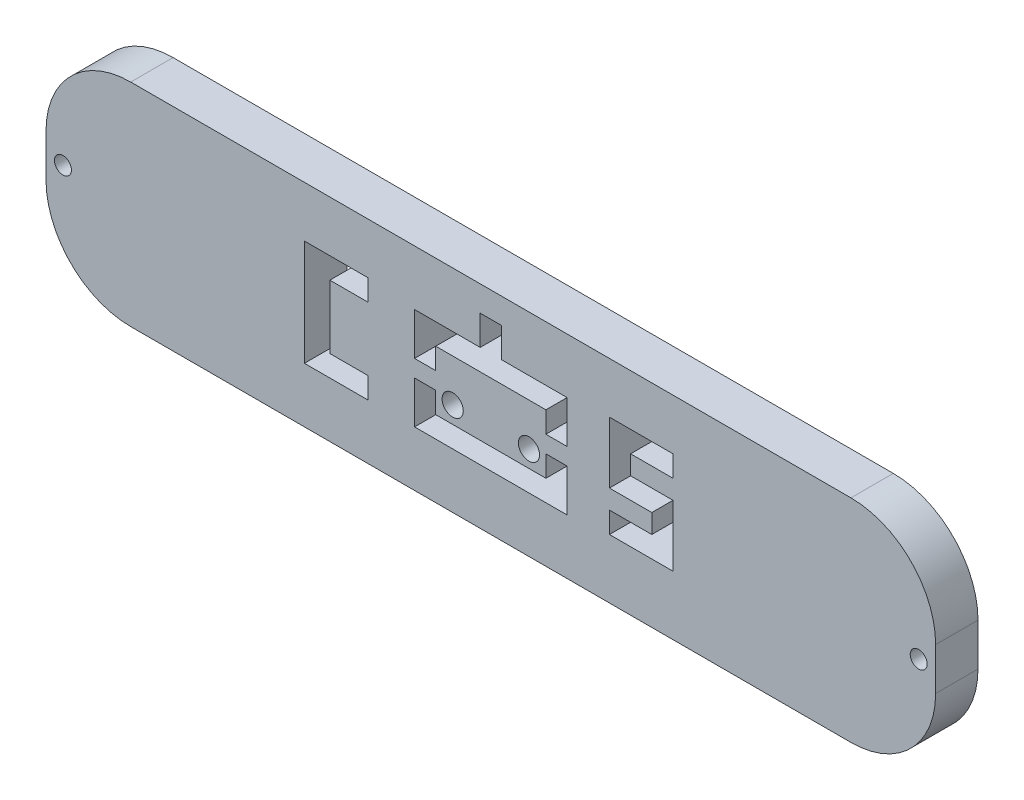
from build123d import *

# Parameters (mm, degrees)
CROQUIS1_W              = 210
CROQUIS1_H              = 50
CROQUIS1_R              = 2.5
CROQUIS1_R_2            = 2
SALIENTE_EXTRUIR1_DEPTH = 10
REDONDEO1_R             = 20


with BuildPart() as part:
    # Croquis1 → Saliente-Extruir1 (new body)
    with BuildSketch(Plane.XY):
        with Locations((105, -25)):
            Rectangle(CROQUIS1_W, CROQUIS1_H)
        with Locations((96, -28)):
            Circle(CROQUIS1_R, mode=Mode.SUBTRACT)
        Polygon((118, -27), (123, -27), (123, -32), (123, -37), (118, -37), (92, -37), (87, -37), (87, -32), (87, -27), (92, -27), (92, -32), (118, -32), align=None, mode=Mode.SUBTRACT)
        with Locations((114, -28)):
            Circle(CROQUIS1_R, mode=Mode.SUBTRACT)
        with Locations((4, -25)):
            Circle(CROQUIS1_R_2, mode=Mode.SUBTRACT)
        Polygon((67, -12), (76, -12), (76, -17), (67, -17), (67, -32), (76, -32), (76, -37), (67, -37), (61, -37), (61, -32), (61, -17), (61, -12), align=None, mode=Mode.SUBTRACT)
        Polygon((138, -12), (148, -12), (148, -17), (138, -17), (138, -21.5), (143, -21.5), (148, -21.5), (148, -26.5), (148, -31), (148, -36), (133, -36), (133, -31), (143, -31), (143, -26.5), (138, -26.5), (133, -26.5), (133, -21.5), (133, -17), (133, -12), align=None, mode=Mode.SUBTRACT)
        Polygon((87, -18), (87, -13), (92, -13), (102.5, -13), (102.5, -6), (107.5, -6), (107.5, -13), (118, -13), (123, -13), (123, -18), (123, -23), (118, -23), (118, -18), (107.5, -18), (102.5, -18), (92, -18), (92, -23), (87, -23), align=None, mode=Mode.SUBTRACT)
        with Locations((206, -25)):
            Circle(CROQUIS1_R_2, mode=Mode.SUBTRACT)
    extrude(amount=SALIENTE_EXTRUIR1_DEPTH)

    # Redondeo1
    redondeo1_edges = [part.edges().sort_by_distance(p)[0] for p in [
        (210, -50, 5),
        (0, -50, 5),
        (0, 0, 5),
        (210, 0, 5),
    ]]
    fillet(redondeo1_edges, radius=REDONDEO1_R)


solid = part.part
